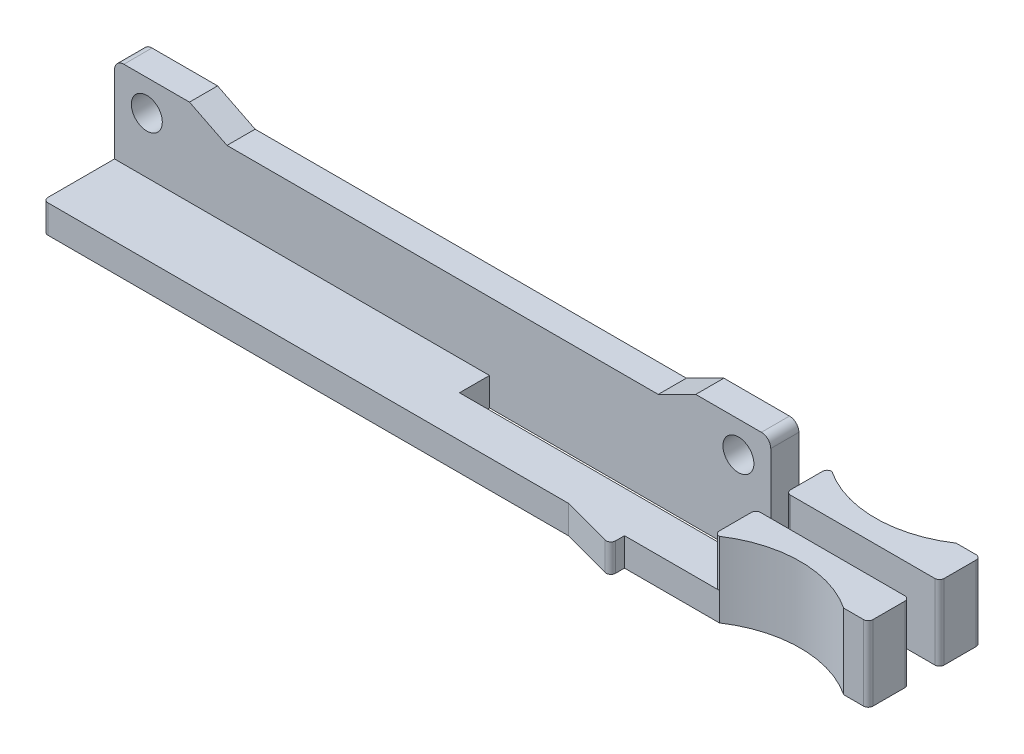
from build123d import *

# Parameters (mm, degrees)
EXTRUDE_1_DEPTH     = 3
SKETCH_4_W          = 70
SKETCH_4_H          = 3
EXTRUDE_2_DEPTH     = 9.25
CUT_EXTRUDE_1_REACH = 91.308
SKETCH_5_R          = 1.65
FILLET_1_R          = 1
EXTRUDE_3_DEPTH     = 5
CUT_EXTRUDE_2_REACH = 91.308


with BuildPart() as part:
    # ｽｹｯﾁ2 → ﾎﾞｽ - 押し出し1 (new body)
    with BuildSketch(Plane(origin=(0, 0, 0), x_dir=(1, 0, 0), z_dir=(0, 1, 0))):
        with BuildLine():
            Line((70, 7.6), (40, 7.6))
            Line((40, 7.6), (40, 4.4))
            Line((40, 4.4), (70, 4.4))
            Line((70, 4.4), (87.5, 4.4))
            ThreePointArc((87.5, 4.4), (87.853553391, 4.253553391), (88, 3.9))
            Line((88, 3.9), (88, 0.5))
            ThreePointArc((88, 0.5), (87.853553391, 0.146446609), (87.5, 0))
            Line((87.5, 0), (85.383249581, 0))
            ThreePointArc((85.383249581, 0), (78.75, 2), (72.116750419, 0))
            Line((72.116750419, 0), (70, 0))
            Line((70, 0), (62, 0))
            Line((62, 0), (62, -0.949194177))
            ThreePointArc((62, -0.949194177), (61.80461807, -1.345688605), (61.371168675, -1.432311647))
            Line((61.371168675, -1.432311647), (56, 0))
            Line((56, 0), (0.5, 0))
            ThreePointArc((0.5, 0), (0.146446609, 0.146446609), (0, 0.5))
            Line((0, 0.5), (0, 11.5))
            ThreePointArc((0, 11.5), (0.146446609, 11.853553391), (0.5, 12))
            Line((0.5, 12), (70, 12))
            Line((70, 12), (72.116750419, 12))
            ThreePointArc((72.116750419, 12), (78.75, 10), (85.383249581, 12))
            Line((85.383249581, 12), (87.5, 12))
            ThreePointArc((87.5, 12), (87.853553391, 11.853553391), (88, 11.5))
            Line((88, 11.5), (88, 8.1))
            ThreePointArc((88, 8.1), (87.853553391, 7.746446609), (87.5, 7.6))
            Line((87.5, 7.6), (70, 7.6))
        make_face()
    extrude(amount=EXTRUDE_1_DEPTH)

    # ｽｹｯﾁ4 → ﾎﾞｽ - 押し出し2 (add)
    with BuildSketch(Plane(origin=(0, 3, 0), x_dir=(1, 0, 0), z_dir=(0, 1, 0))):
        with Locations((35, 9.1)):
            Rectangle(SKETCH_4_W, SKETCH_4_H)
    extrude(amount=EXTRUDE_2_DEPTH)

    # ｽｹｯﾁ5 → ｶｯﾄ - 押し出し1 (cut, up to next)
    with BuildSketch(Plane.XY.offset(-7.6), mode=Mode.PRIVATE) as cut_extrude_1_sk1:
        with Locations((3.45, 8.95)):
            Circle(SKETCH_5_R)
    cut_extrude_1_tool1 = extrude(cut_extrude_1_sk1.sketch, amount=-CUT_EXTRUDE_1_REACH, mode=Mode.PRIVATE) & part.part
    # ｽｹｯﾁ5 → ｶｯﾄ - 押し出し1 (cut, up to next)
    with BuildSketch(Plane.XY.offset(-7.6), mode=Mode.PRIVATE) as cut_extrude_1_sk2:
        with Locations((66.55, 8.95)):
            Circle(SKETCH_5_R)
    cut_extrude_1_tool2 = extrude(cut_extrude_1_sk2.sketch, amount=-CUT_EXTRUDE_1_REACH, mode=Mode.PRIVATE) & part.part
    add(cut_extrude_1_tool1.solids().sort_by_distance((3.45, 8.95, -7.6))[0], mode=Mode.SUBTRACT)
    add(cut_extrude_1_tool2.solids().sort_by_distance((66.55, 8.95, -7.6))[0], mode=Mode.SUBTRACT)

    # ﾌｨﾚｯﾄ1
    fillet_1_edges = [part.edges().sort_by_distance(p)[0] for p in [
        (70, 12.25, -9.1),
        (0, 12.25, -9.1),
    ]]
    fillet(fillet_1_edges, radius=FILLET_1_R)

    # ｽｹｯﾁ6 → ﾎﾞｽ - 押し出し3 (add)
    with BuildSketch(Plane(origin=(0, 3, 0), x_dir=(1, 0, 0), z_dir=(0, 1, 0))):
        with BuildLine():
            Line((88, 11.5), (88, 8.1))
            ThreePointArc((88, 8.1), (87.853553391, 7.746446609), (87.5, 7.6))
            Line((87.5, 7.6), (72.116750419, 7.6))
            ThreePointArc((72.116750419, 7.6), (71.763197029, 7.746446609), (71.616750419, 8.1))
            Line((71.616750419, 8.1), (71.616750419, 11.5))
            ThreePointArc((71.616750419, 11.5), (71.763197029, 11.853553391), (72.116750419, 12))
            ThreePointArc((72.116750419, 12), (78.75, 10), (85.383249581, 12))
            Line((85.383249581, 12), (87.5, 12))
            ThreePointArc((87.5, 12), (87.853553391, 11.853553391), (88, 11.5))
        make_face()
        with BuildLine():
            Line((88, 3.9), (88, 0.5))
            ThreePointArc((88, 0.5), (87.853553391, 0.146446609), (87.5, 0))
            Line((87.5, 0), (85.383249581, 0))
            ThreePointArc((85.383249581, 0), (78.75, 2), (72.116750419, 0))
            ThreePointArc((72.116750419, 0), (71.763197029, 0.146446609), (71.616750419, 0.5))
            Line((71.616750419, 0.5), (71.616750419, 3.9))
            ThreePointArc((71.616750419, 3.9), (71.763197029, 4.253553391), (72.116750419, 4.4))
            Line((72.116750419, 4.4), (87.5, 4.4))
            ThreePointArc((87.5, 4.4), (87.853553391, 4.253553391), (88, 3.9))
        make_face()
    extrude(amount=EXTRUDE_3_DEPTH)

    # ｽｹｯﾁ7 → ｶｯﾄ - 押し出し2 (cut, up to next)
    with BuildSketch(Plane.XY.offset(-7.6), mode=Mode.PRIVATE) as cut_extrude_2_sk1:
        Polygon((8, 12.25), (12, 10.25), (58, 10.25), (62, 12.25), align=None)
    cut_extrude_2_tool1 = extrude(cut_extrude_2_sk1.sketch, amount=-CUT_EXTRUDE_2_REACH, mode=Mode.PRIVATE) & part.part
    add(cut_extrude_2_tool1.solids().sort_by_distance((35, 11.276667, -7.6))[0], mode=Mode.SUBTRACT)


solid = part.part
